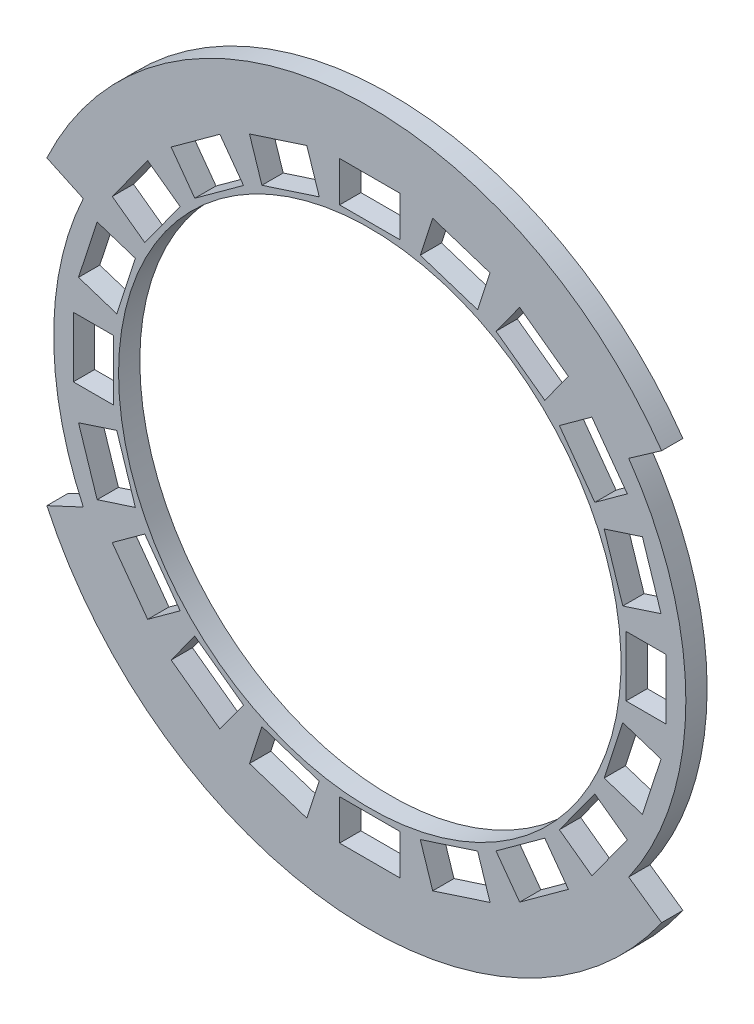
from build123d import *

# Parameters (mm, degrees)
SKETCH1_R           = 75
BOSS_EXTRUDE1_DEPTH = 6.35
SKETCH2_W           = 18
SKETCH2_H           = 12
CUT_EXTRUDE1_DEPTH  = 144.69092772
CIRPATTERN1_COUNT   = 20


with BuildPart() as part:
    # Sketch1 → Boss-Extrude1 (new body)
    with BuildSketch(Plane.XY):
        with BuildLine():
            Line((-85.524663655, 39.880805624), (-96.4003571, 44.952224764))
            ThreePointArc((-96.4003571, 44.952224764), (-9.270409947, 105.961270564), (87.129947152, 61.0090458))
            Line((87.129947152, 61.0090458), (77.300122621, 54.126128564))
            ThreePointArc((77.300122621, 54.126128564), (8.224541034, -94.006934187), (-85.524663655, 39.880805624))
        make_face()
        with Locations(Location((0, 0, 0), (0, 0, 180))):
            Circle(SKETCH1_R, mode=Mode.SUBTRACT)
    boss_extrude1 = extrude(amount=BOSS_EXTRUDE1_DEPTH)

    # Mirror1: Boss-Extrude1 across plane
    add(boss_extrude1.mirror(Plane.ZX))

    # Sketch2 → Cut-Extrude1 (cut, through all)
    with BuildSketch(Plane.XY.offset(6.35)):
        with Locations((0, 82.5)):
            Rectangle(SKETCH2_W, SKETCH2_H)
    cut_extrude1 = extrude(amount=-CUT_EXTRUDE1_DEPTH, mode=Mode.SUBTRACT)

    # CirPattern1: Cut-Extrude1 ×20 about axis
    cirpattern1_axis = Axis((0, 0, 0), (0, 0, 1))
    for i in range(1, CIRPATTERN1_COUNT):
        add(cut_extrude1.rotate(cirpattern1_axis, i * 360 / CIRPATTERN1_COUNT), mode=Mode.SUBTRACT)


solid = part.part
